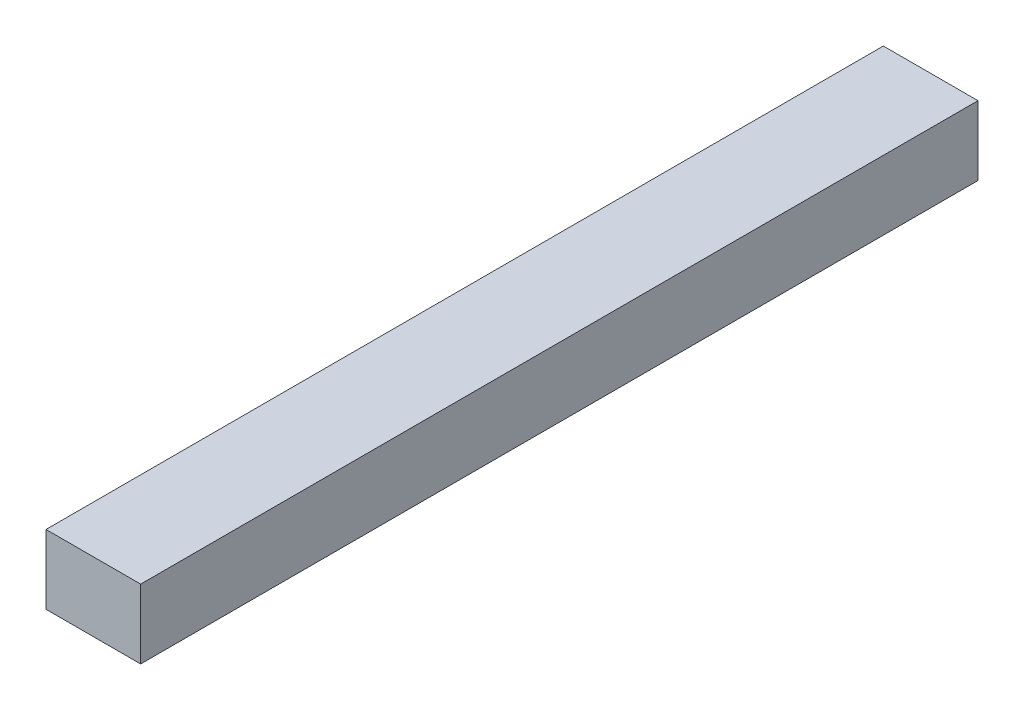
from build123d import *

# Parameters (mm, degrees)
SKETCH1_W           = 13
SKETCH1_H           = 9.5
BOSS_EXTRUDE1_DEPTH = 57.5


with BuildPart() as part:
    # Sketch1 → Boss-Extrude1 (new, symmetric)
    with BuildSketch(Plane.XY):
        Rectangle(SKETCH1_W, SKETCH1_H)
    extrude(amount=BOSS_EXTRUDE1_DEPTH, both=True)


solid = part.part
